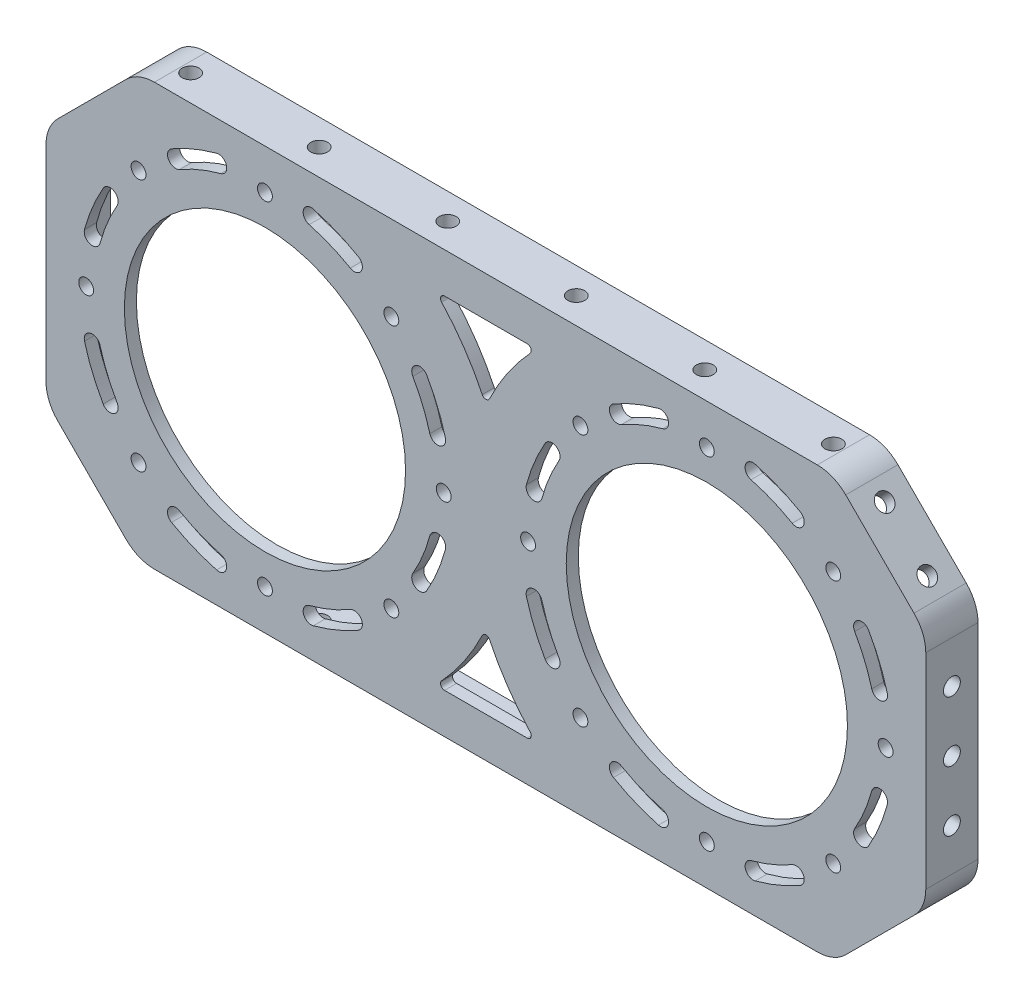
from build123d import *

# Parameters (mm, degrees)
SKETCH_1_W          = 250
SKETCH_1_H          = 120
SKETCH_1_R          = 1.85
SKETCH_1_R_2        = 35
EXTRUDE_1_DEPTH     = 3
SKETCH_2_W          = 250
SKETCH_2_H          = 120
SKETCH_2_W_2        = 219
SKETCH_2_H_2        = 105
CUT_EXTRUDE_1_DEPTH = 140.25957727
EXTRUDE_2_DEPTH     = 10
SKETCH_6_R          = 2.1
CUT_EXTRUDE_2_DEPTH = 5
SKETCH_7_R          = 2.1
CUT_EXTRUDE_3_DEPTH = 226.469422529
SKETCH_8_R          = 2.1
CUT_EXTRUDE_4_DEPTH = 5
SKETCH_10_R         = 2.1
CUT_EXTRUDE_6_DEPTH = 5
SKETCH_11_R         = 2.1
CUT_EXTRUDE_7_DEPTH = 5
FILLET_1_R          = 10
SKETCH_9_R          = 2.1
CUT_EXTRUDE_8_DEPTH = 250
CUT_EXTRUDE_9_DEPTH = 250
FILLET_2_R          = 1
FILLET_3_R          = 1
FILLET_4_R          = 1
FILLET_5_R          = 1
FILLET_6_R          = 1
FILLET_7_R          = 1


with BuildPart() as part:
    # 草图1 → 凸台-拉伸1 (new body)
    with BuildSketch(Plane.XY):
        with Locations((-0.547918241, 0.182639414)):
            Rectangle(SKETCH_1_W, SKETCH_1_H)
        with Locations((54.452081759, 42.682639414)):
            Circle(SKETCH_1_R, mode=Mode.SUBTRACT)
        with Locations((85.918333522, 31.648891176)):
            Circle(SKETCH_1_R, mode=Mode.SUBTRACT)
        with Locations((98.952081759, 0.182639414)):
            Circle(SKETCH_1_R, mode=Mode.SUBTRACT)
        with Locations((85.918333522, -31.283612349)):
            Circle(SKETCH_1_R, mode=Mode.SUBTRACT)
        with Locations((22.985829996, -31.283612349)):
            Circle(SKETCH_1_R, mode=Mode.SUBTRACT)
        with Locations((22.985829996, 31.648891176)):
            Circle(SKETCH_1_R, mode=Mode.SUBTRACT)
        with Locations((54.452081759, -42.317360586)):
            Circle(SKETCH_1_R, mode=Mode.SUBTRACT)
        with Locations((9.952081759, 0.182639414)):
            Circle(SKETCH_1_R, mode=Mode.SUBTRACT)
        with Locations((54.452081759, 0.182639414)):
            Circle(SKETCH_1_R_2, mode=Mode.SUBTRACT)
        with Locations((-55.547918241, 0.182639414)):
            Circle(SKETCH_1_R_2, mode=Mode.SUBTRACT)
        with Locations((-87.014170004, 31.648891176)):
            Circle(SKETCH_1_R, mode=Mode.SUBTRACT)
        with Locations((-11.047918241, 0.182639414)):
            Circle(SKETCH_1_R, mode=Mode.SUBTRACT)
        with Locations((-55.547918241, 42.682639414)):
            Circle(SKETCH_1_R, mode=Mode.SUBTRACT)
        with Locations((-24.081666478, 31.648891176)):
            Circle(SKETCH_1_R, mode=Mode.SUBTRACT)
        with Locations((-24.081666478, -31.283612349)):
            Circle(SKETCH_1_R, mode=Mode.SUBTRACT)
        with Locations((-55.547918241, -42.317360586)):
            Circle(SKETCH_1_R, mode=Mode.SUBTRACT)
        with Locations((-87.014170004, -31.283612349)):
            Circle(SKETCH_1_R, mode=Mode.SUBTRACT)
        with Locations((-100.047918241, 0.182639414)):
            Circle(SKETCH_1_R, mode=Mode.SUBTRACT)
    extrude(amount=EXTRUDE_1_DEPTH)

    # 草图2 → 切除-拉伸1 (cut, through all)
    # profile 1 of 5: a face of its own
    with BuildSketch(Plane.XY.offset(3)):
        with Locations((-0.547918241, 0.182639414)):
            Rectangle(SKETCH_2_W, SKETCH_2_H)
        with Locations((-0.547918241, 0.182639414)):
            Rectangle(SKETCH_2_W_2, SKETCH_2_H_2, mode=Mode.SUBTRACT)
    # profile 2 of 5: a face of its own
    with BuildSketch(Plane.XY.offset(3)):
        Polygon((-110.047918241, 29.828346375), (-87.193625202, 52.682639414), (-110.047918241, 52.682639414), align=None)
    # profile 3 of 5: a face of its own
    with BuildSketch(Plane.XY.offset(3)):
        Polygon((-87.193625202, -52.317360586), (-110.047918241, -29.463067548), (-110.047918241, -52.317360586), align=None)
    # profile 4 of 5: a face of its own
    with BuildSketch(Plane.XY.offset(3)):
        Polygon((108.952081759, -52.317360586), (108.952081759, -29.463067548), (86.09778872, -52.317360586), align=None)
    # profile 5 of 5: a face of its own
    with BuildSketch(Plane.XY.offset(3)):
        Polygon((108.952081759, 52.682639414), (86.09778872, 52.682639414), (108.952081759, 29.828346375), align=None)
    extrude(amount=-CUT_EXTRUDE_1_DEPTH, mode=Mode.SUBTRACT)

    # 草图3 → 凸台-拉伸2 (add)
    with BuildSketch(Plane(origin=(0, 0, 0), x_dir=(-1, 0, 0), z_dir=(0, 0, -1))):
        Polygon((-108.952081759, 29.828346375), (-108.952081759, -29.463067548), (-86.09778872, -52.317360586), (87.193625202, -52.317360586), (110.047918241, -29.463067548), (110.047918241, 29.828346375), (87.193625202, 52.682639414), (-86.09778872, 52.682639414), align=None)
        Polygon((-105.952081759, 28.585705688), (-105.952081759, -28.22042686), (-84.855148033, -49.317360586), (85.950984515, -49.317360586), (107.047918241, -28.22042686), (107.047918241, 28.585705688), (85.950984515, 49.682639414), (-84.855148033, 49.682639414), align=None, mode=Mode.SUBTRACT)
    extrude(amount=EXTRUDE_2_DEPTH)

    # 草图6 → 切除-拉伸2 (cut)
    with BuildSketch(Plane(origin=(69.390214067, 69.390214067, 0), x_dir=(0, 0, -1), z_dir=(0.707106781186539, 0.707106781186556, 0))):
        with Locations(Location((3.5, -32.288504256, 0), (0, 0, 90))):
            Circle(SKETCH_6_R)
        with Locations(Location((3.5, -47.288504256, 0), (0, 0, 90))):
            Circle(SKETCH_6_R)
    extrude(amount=-CUT_EXTRUDE_2_DEPTH, mode=Mode.SUBTRACT)

    # 草图7 → 切除-拉伸3 (cut, through all)
    with BuildSketch(Plane(origin=(108.952081759, 0, 0), x_dir=(0, 0, -1), z_dir=(1, 0, 0))):
        with Locations((3.5, 15.182639414)):
            Circle(SKETCH_7_R)
        with Locations((3.5, 0.182639414)):
            Circle(SKETCH_7_R)
        with Locations((3.5, -14.817360586)):
            Circle(SKETCH_7_R)
    extrude(amount=-CUT_EXTRUDE_3_DEPTH, mode=Mode.SUBTRACT)

    # 草图8 → 切除-拉伸4 (cut)
    with BuildSketch(Plane(origin=(69.207574653, -69.207574653, 0), x_dir=(0, 0, -1), z_dir=(0.7071067811865441, -0.7071067811865509, 0))):
        with Locations(Location((3.5, 47.546795392, 0), (0, 0, 90))):
            Circle(SKETCH_8_R)
        with Locations(Location((3.5, 32.546795392, 0), (0, 0, 90))):
            Circle(SKETCH_8_R)
    extrude(amount=-CUT_EXTRUDE_4_DEPTH, mode=Mode.SUBTRACT)

    # 草图10 → 切除-拉伸6 (cut)
    with BuildSketch(Plane(origin=(-69.755492894, -69.755492894, 0), x_dir=(0, 0, 1), z_dir=(-0.7071067811865389, -0.7071067811865561, 0))):
        with Locations(Location((-3.5, 48.321668799, 0), (0, 0, 270))):
            Circle(SKETCH_10_R)
        with Locations(Location((-3.5, 33.321668799, 0), (0, 0, 270))):
            Circle(SKETCH_10_R)
    extrude(amount=-CUT_EXTRUDE_6_DEPTH, mode=Mode.SUBTRACT)

    # 草图11 → 切除-拉伸7 (cut)
    with BuildSketch(Plane(origin=(-69.938132308, 69.938132308, 0), x_dir=(0, 0, 1), z_dir=(-0.7071067811865535, 0.7071067811865417, 0))):
        with Locations(Location((-3.5, -33.063377663, 0), (0, 0, 270))):
            Circle(SKETCH_11_R)
        with Locations(Location((-3.5, -48.063377663, 0), (0, 0, 270))):
            Circle(SKETCH_11_R)
    extrude(amount=-CUT_EXTRUDE_7_DEPTH, mode=Mode.SUBTRACT)

    # 圆角1
    fillet_1_edges = [part.edges().sort_by_distance(p)[0] for p in [
        (108.952081759, -29.463067548, -3.5),
        (108.952081759, 29.828346375, -3.5),
        (86.09778872, 52.682639414, -3.5),
        (-87.193625202, 52.682639414, -3.5),
        (-110.047918241, 29.828346375, -3.5),
        (-110.047918241, -29.463067548, -3.5),
        (-87.193625202, -52.317360586, -3.5),
        (86.09778872, -52.317360586, -3.5),
        (105.952081759, 28.585705688, -5),
        (105.952081759, -28.22042686, -5),
        (84.855148033, -49.317360586, -5),
        (-85.950984515, -49.317360586, -5),
        (-107.047918241, -28.22042686, -5),
        (-107.047918241, 28.585705688, -5),
        (-85.950984515, 49.682639414, -5),
        (84.855148033, 49.682639414, -5),
    ]]
    fillet(fillet_1_edges, radius=FILLET_1_R)

    # 草图9 → 切除-拉伸8 (cut)
    with BuildSketch(Plane.XZ.offset(52.317360586)):
        with Locations((-80.547918241, -3.5)):
            Circle(SKETCH_9_R)
        with Locations((-48.547918241, -3.5)):
            Circle(SKETCH_9_R)
        with Locations((-16.547918241, -3.5)):
            Circle(SKETCH_9_R)
        with Locations((15.452081759, -3.5)):
            Circle(SKETCH_9_R)
        with Locations((47.452081759, -3.5)):
            Circle(SKETCH_9_R)
        with Locations((79.452081759, -3.5)):
            Circle(SKETCH_9_R)
    extrude(amount=-CUT_EXTRUDE_8_DEPTH, mode=Mode.SUBTRACT)

    # 草图12 → 切除-拉伸9 (cut)
    with BuildSketch(Plane.XY.offset(3)):
        with BuildLine():
            Line((12.099395894, 42.682639414), (-13.195232376, 42.682639414))
            ThreePointArc((-13.195232376, 42.682639414), (-5.998531141, 34.018393256), (-0.547918241, 24.16179703))
            ThreePointArc((-0.547918241, 24.16179703), (4.902694659, 34.018393256), (12.099395894, 42.682639414))
        make_face()
        with BuildLine():
            ThreePointArc((-0.547918241, -23.796518203), (-5.998531141, -33.653114428), (-13.195232376, -42.317360586))
            Line((-13.195232376, -42.317360586), (12.099395894, -42.317360586))
            ThreePointArc((12.099395894, -42.317360586), (4.902694659, -33.653114428), (-0.547918241, -23.796518203))
        make_face()
        with BuildLine():
            ThreePointArc((-67.583003895, 45.098190321), (-73.342697873, 43.143037664), (-78.797918241, 40.45282069))
            ThreePointArc((-78.797918241, 40.45282069), (-79.529969049, 37.720769882), (-76.797918241, 36.988719074))
            ThreePointArc((-76.797918241, 36.988719074), (-71.811964116, 39.447519545), (-66.547727658, 41.234487031))
            ThreePointArc((-66.547727658, 41.234487031), (-65.133514103, 43.683976802), (-67.583003895, 45.098190321))
        make_face()
        with BuildLine():
            ThreePointArc((-32.297918292, 40.452820719), (-37.753138663, 43.143037687), (-43.512832644, 45.098190336))
            ThreePointArc((-43.512832644, 45.098190336), (-45.962322386, 43.683976774), (-44.548108824, 41.234487031))
            ThreePointArc((-44.548108824, 41.234487031), (-39.283872365, 39.447519545), (-34.297918241, 36.988719074))
            ThreePointArc((-34.297918241, 36.988719074), (-31.565867419, 37.720769908), (-32.297918292, 40.452820719))
        make_face()
        with BuildLine():
            ThreePointArc((-92.353997902, 21.432639414), (-94.812798373, 16.446685289), (-96.599765858, 11.182448831))
            ThreePointArc((-96.599765858, 11.182448831), (-99.049255601, 9.768235268), (-100.463469163, 12.217725011))
            ThreePointArc((-100.463469163, 12.217725011), (-98.508316514, 17.977418991), (-95.818099546, 23.432639363))
            ThreePointArc((-95.818099546, 23.432639363), (-93.086048735, 24.164690236), (-92.353997902, 21.432639414))
        make_face()
        with BuildLine():
            ThreePointArc((-100.463469148, -11.852446241), (-98.508316491, -17.612140219), (-95.818099517, -23.067360586))
            ThreePointArc((-95.818099517, -23.067360586), (-93.086048709, -23.799411394), (-92.353997902, -21.067360586))
            ThreePointArc((-92.353997902, -21.067360586), (-94.812798373, -16.081406462), (-96.599765858, -10.817170003))
            ThreePointArc((-96.599765858, -10.817170003), (-99.04925563, -9.402956448), (-100.463469148, -11.852446241))
        make_face()
        with BuildLine():
            ThreePointArc((-78.79791819, -40.087541892), (-73.342697819, -42.777758859), (-67.583003838, -44.732911509))
            ThreePointArc((-67.583003838, -44.732911509), (-65.133514095, -43.318697946), (-66.547727658, -40.869208204))
            ThreePointArc((-66.547727658, -40.869208204), (-71.811964116, -39.082240718), (-76.797918241, -36.623440247))
            ThreePointArc((-76.797918241, -36.623440247), (-79.529969063, -37.35549108), (-78.79791819, -40.087541892))
        make_face()
        with BuildLine():
            ThreePointArc((-43.512832587, -44.732911494), (-37.753138609, -42.777758837), (-32.297918241, -40.087541862))
            ThreePointArc((-32.297918241, -40.087541862), (-31.565867433, -37.355491055), (-34.297918241, -36.623440247))
            ThreePointArc((-34.297918241, -36.623440247), (-39.283872365, -39.082240718), (-44.548108824, -40.869208204))
            ThreePointArc((-44.548108824, -40.869208204), (-45.962322379, -43.318697975), (-43.512832587, -44.732911494))
        make_face()
        with BuildLine():
            ThreePointArc((-15.277736935, -23.067360535), (-12.587519968, -17.612140164), (-10.632367319, -11.852446184))
            ThreePointArc((-10.632367319, -11.852446184), (-12.046580881, -9.402956441), (-14.496070624, -10.817170003))
            ThreePointArc((-14.496070624, -10.817170003), (-16.283038109, -16.081406462), (-18.74183858, -21.067360586))
            ThreePointArc((-18.74183858, -21.067360586), (-18.009787747, -23.799411409), (-15.277736935, -23.067360535))
        make_face()
        with BuildLine():
            ThreePointArc((-10.632367334, 12.217725068), (-12.58751999, 17.977419046), (-15.277736965, 23.432639414))
            ThreePointArc((-15.277736965, 23.432639414), (-18.009787773, 24.164690221), (-18.74183858, 21.432639414))
            ThreePointArc((-18.74183858, 21.432639414), (-16.283038109, 16.446685289), (-14.496070624, 11.182448831))
            ThreePointArc((-14.496070624, 11.182448831), (-12.046580852, 9.768235276), (-10.632367334, 12.217725068))
        make_face()
        with BuildLine():
            ThreePointArc((9.536530852, 12.217725068), (11.491683509, 17.977419046), (14.181900483, 23.432639414))
            ThreePointArc((14.181900483, 23.432639414), (16.913951291, 24.164690221), (17.646002098, 21.432639414))
            ThreePointArc((17.646002098, 21.432639414), (15.187201627, 16.446685289), (13.400234142, 11.182448831))
            ThreePointArc((13.400234142, 11.182448831), (10.95074437, 9.768235276), (9.536530852, 12.217725068))
        make_face()
        with BuildLine():
            ThreePointArc((31.20208181, 40.452820719), (36.657302181, 43.143037687), (42.416996162, 45.098190336))
            ThreePointArc((42.416996162, 45.098190336), (44.866485905, 43.683976774), (43.452272342, 41.234487031))
            ThreePointArc((43.452272342, 41.234487031), (38.188035884, 39.447519545), (33.202081759, 36.988719074))
            ThreePointArc((33.202081759, 36.988719074), (30.470030937, 37.720769908), (31.20208181, 40.452820719))
        make_face()
        with BuildLine():
            ThreePointArc((66.487167413, 45.098190321), (72.246861391, 43.143037664), (77.702081759, 40.45282069))
            ThreePointArc((77.702081759, 40.45282069), (78.434132567, 37.720769882), (75.702081759, 36.988719074))
            ThreePointArc((75.702081759, 36.988719074), (70.716127635, 39.447519545), (65.451891176, 41.234487031))
            ThreePointArc((65.451891176, 41.234487031), (64.037677621, 43.683976802), (66.487167413, 45.098190321))
        make_face()
        with BuildLine():
            ThreePointArc((14.181900454, -23.067360535), (11.491683486, -17.612140164), (9.536530837, -11.852446184))
            ThreePointArc((9.536530837, -11.852446184), (10.950744399, -9.402956441), (13.400234142, -10.817170003))
            ThreePointArc((13.400234142, -10.817170003), (15.187201627, -16.081406462), (17.646002098, -21.067360586))
            ThreePointArc((17.646002098, -21.067360586), (16.913951265, -23.799411409), (14.181900454, -23.067360535))
        make_face()
        with BuildLine():
            ThreePointArc((42.416996105, -44.732911494), (36.657302127, -42.777758837), (31.202081759, -40.087541862))
            ThreePointArc((31.202081759, -40.087541862), (30.470030951, -37.355491055), (33.202081759, -36.623440247))
            ThreePointArc((33.202081759, -36.623440247), (38.188035884, -39.082240718), (43.452272342, -40.869208204))
            ThreePointArc((43.452272342, -40.869208204), (44.866485897, -43.318697975), (42.416996105, -44.732911494))
        make_face()
        with BuildLine():
            ThreePointArc((77.702081708, -40.087541892), (72.246861337, -42.777758859), (66.487167356, -44.732911509))
            ThreePointArc((66.487167356, -44.732911509), (64.037677614, -43.318697946), (65.451891176, -40.869208204))
            ThreePointArc((65.451891176, -40.869208204), (70.716127635, -39.082240718), (75.702081759, -36.623440247))
            ThreePointArc((75.702081759, -36.623440247), (78.434132581, -37.35549108), (77.702081708, -40.087541892))
        make_face()
        with BuildLine():
            ThreePointArc((99.367632666, -11.852446241), (97.41248001, -17.612140219), (94.722263035, -23.067360586))
            ThreePointArc((94.722263035, -23.067360586), (91.990212227, -23.799411394), (91.25816142, -21.067360586))
            ThreePointArc((91.25816142, -21.067360586), (93.716961891, -16.081406462), (95.503929376, -10.817170003))
            ThreePointArc((95.503929376, -10.817170003), (97.953419148, -9.402956448), (99.367632666, -11.852446241))
        make_face()
        with BuildLine():
            ThreePointArc((94.722263065, 23.432639363), (97.412480032, 17.977418991), (99.367632681, 12.217725011))
            ThreePointArc((99.367632681, 12.217725011), (97.953419119, 9.768235268), (95.503929376, 11.182448831))
            ThreePointArc((95.503929376, 11.182448831), (93.716961891, 16.446685289), (91.25816142, 21.432639414))
            ThreePointArc((91.25816142, 21.432639414), (91.990212253, 24.164690236), (94.722263065, 23.432639363))
        make_face()
    extrude(amount=-CUT_EXTRUDE_9_DEPTH, mode=Mode.SUBTRACT)

    # 圆角2
    fillet_2_edges = [part.edges().sort_by_distance(p)[0] for p in [
        (-13.195232376, 42.682639414, 1.5),
    ]]
    fillet(fillet_2_edges, radius=FILLET_2_R)

    # 圆角3
    fillet_3_edges = [part.edges().sort_by_distance(p)[0] for p in [
        (12.099395894, 42.682639414, 1.5),
    ]]
    fillet(fillet_3_edges, radius=FILLET_3_R)

    # 圆角4
    fillet_4_edges = [part.edges().sort_by_distance(p)[0] for p in [
        (-0.547918241, 24.16179703, 1.5),
    ]]
    fillet(fillet_4_edges, radius=FILLET_4_R)

    # 圆角5
    fillet_5_edges = [part.edges().sort_by_distance(p)[0] for p in [
        (-0.547918241, -23.796518203, 1.5),
    ]]
    fillet(fillet_5_edges, radius=FILLET_5_R)

    # 圆角6
    fillet_6_edges = [part.edges().sort_by_distance(p)[0] for p in [
        (-13.195232376, -42.317360586, 1.5),
    ]]
    fillet(fillet_6_edges, radius=FILLET_6_R)

    # 圆角7
    fillet_7_edges = [part.edges().sort_by_distance(p)[0] for p in [
        (12.099395894, -42.317360586, 1.5),
    ]]
    fillet(fillet_7_edges, radius=FILLET_7_R)


solid = part.part
